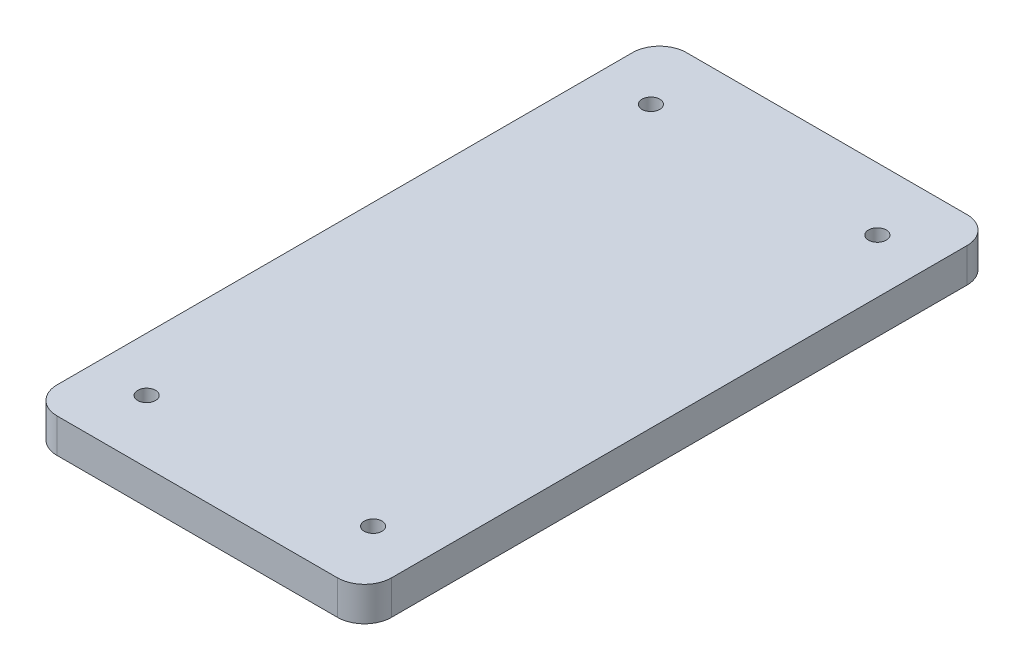
from build123d import *

# Parameters (mm, degrees)
CROQUIS2_W              = 62
CROQUIS2_H              = 116.7
CROQUIS2_R              = 1.65
SALIENTE_EXTRUIR1_DEPTH = 6.35
REDONDEO2_R             = 5


with BuildPart() as part:
    # Croquis2 → Saliente-Extruir1 (new body)
    with BuildSketch(Plane(origin=(0, 0, 0), x_dir=(1, 0, 0), z_dir=(0, 1, 0))):
        with Locations((31, 58.35)):
            Rectangle(CROQUIS2_W, CROQUIS2_H)
        with Locations(Location((10, 11.6, 0), (0, 0, 270))):
            Circle(CROQUIS2_R, mode=Mode.SUBTRACT)
        with Locations(Location((52, 11.6, 0), (0, 0, 270))):
            Circle(CROQUIS2_R, mode=Mode.SUBTRACT)
        with Locations(Location((10, 105.1, 0), (0, 0, 90))):
            Circle(CROQUIS2_R, mode=Mode.SUBTRACT)
        with Locations(Location((52, 105.1, 0), (0, 0, 90))):
            Circle(CROQUIS2_R, mode=Mode.SUBTRACT)
    extrude(amount=SALIENTE_EXTRUIR1_DEPTH)

    # Redondeo2
    redondeo2_edges = [part.edges().sort_by_distance(p)[0] for p in [
        (0, 3.175, -116.7),
        (62, 3.175, -116.7),
        (62, 3.175, 0),
        (0, 3.175, 0),
    ]]
    fillet(redondeo2_edges, radius=REDONDEO2_R)


solid = part.part
